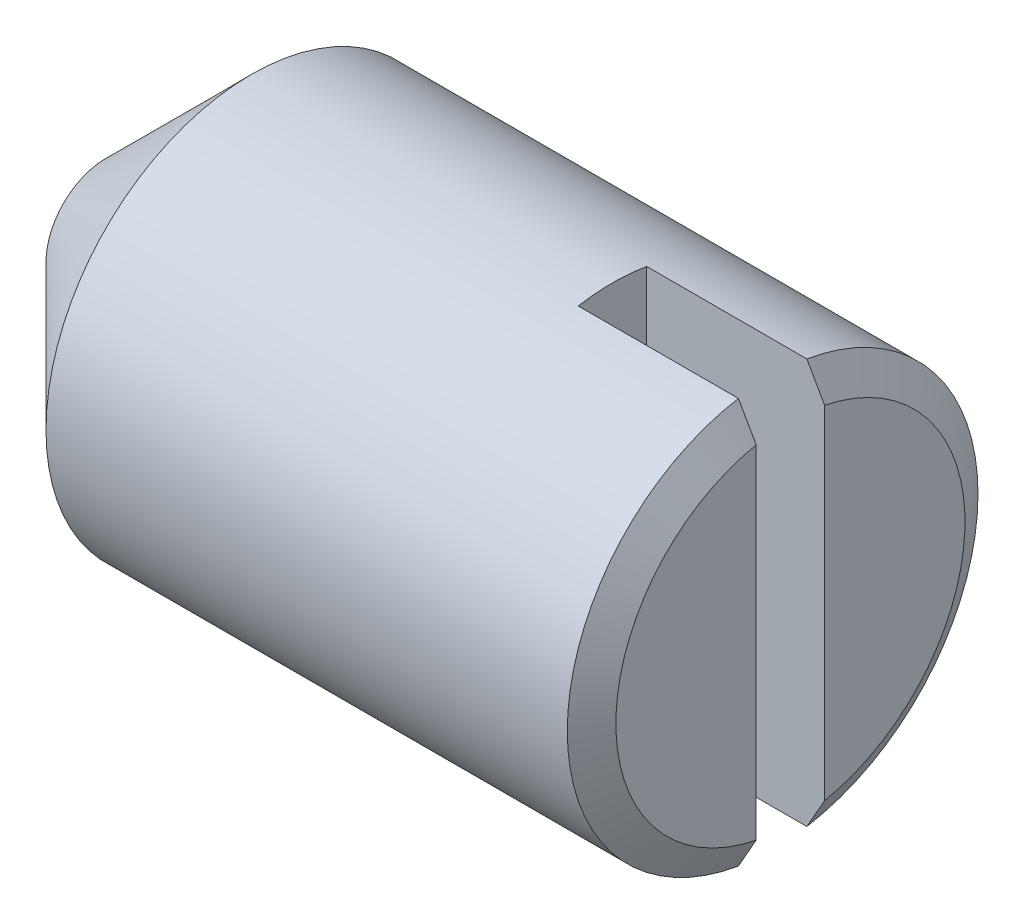
from build123d import *

# Parameters (mm, degrees)
SKICA2_W                 = 0.2
SKICA2_H                 = 1.2
ODEBRAT_VYSUNUT_M1_DEPTH = 0.52


with BuildPart() as part:
    # Skica1 → Otočit kolem osy1 (revolve)
    with BuildSketch(Plane(origin=(0, 0, 0), x_dir=(1, 0, 0), z_dir=(0, 1, 0))):
        Polygon((0, 0), (0, 0.175), (0.425, 0.6), (1.948038476, 0.6), (2, 0.51), (2, 0), align=None)
    revolve(axis=Axis((2, 0, 0), (-1, 0, 0)))

    # Skica2 → Odebrat vysunutím1 (cut)
    with BuildSketch(Plane(origin=(2, 0, 0), x_dir=(0, 0, -1), z_dir=(1, 0, 0))):
        Rectangle(SKICA2_W, SKICA2_H)
    extrude(amount=-ODEBRAT_VYSUNUT_M1_DEPTH, mode=Mode.SUBTRACT)


solid = part.part
